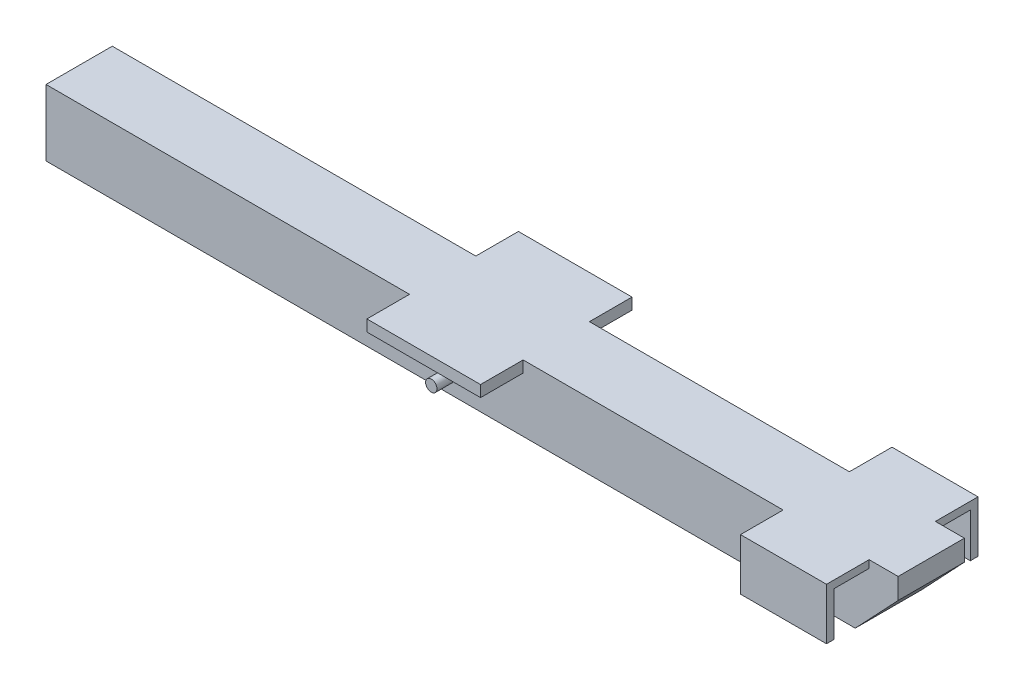
from build123d import *

# Parameters (mm, degrees)
BOSS_EXTRUDE1_DEPTH      = 889
BOSS_EXTRUDE3_DEPTH      = 571.5
BOSS_EXTRUDE3_DEPTH_BACK = 1460.5
SKETCH5_W                = 1153.702812307
SKETCH5_H                = 691.768195519
SKETCH5_W_2              = 1524
SKETCH5_H_2              = 152.4
CUT_EXTRUDE3_REACH       = 11174.441
SKETCH6_W                = 468.477816715
SKETCH6_H                = 590.168195519
BOSS_EXTRUDE4_DEPTH      = 469.9
BOSS_EXTRUDE4_DEPTH_BACK = 1358.9
SKETCH7_R                = 76.2
SKETCH8_W                = 736.6
SKETCH8_H                = 736.6
CUT_EXTRUDE4_DEPTH       = 10551.414


with BuildPart() as part:
    # Sketch1 → Boss-Extrude1 (new body)
    with BuildSketch(Plane.XY):
        Polygon((0, 0), (10854.702616032, 0), (11430, 609.6), (11430, 889), (0, 889), align=None)
    extrude(amount=BOSS_EXTRUDE1_DEPTH)

    # Sketch5 → Boss-Extrude3 (add, two sides: drawn at the far end of the back side and taken through both)
    with BuildSketch(Plane.XY.offset(889).offset(-BOSS_EXTRUDE3_DEPTH_BACK)):
        with Locations((10463.984643528, 543.11590224)):
            Rectangle(SKETCH5_W, SKETCH5_H)
        with Locations((5637.984643529, 812.8)):
            Rectangle(SKETCH5_W_2, SKETCH5_H_2)
    extrude(amount=BOSS_EXTRUDE3_DEPTH + BOSS_EXTRUDE3_DEPTH_BACK)

    # Sketch6 → Cut-Extrude3 (cut, up to next)
    with BuildSketch(Plane(origin=(11040.836049682, 0, 0), x_dir=(0, 0, -1), z_dir=(1, 0, 0)), mode=Mode.PRIVATE) as cut_extrude3_sk1:
        with Locations((-1123.238908357, 492.315902241)):
            Rectangle(SKETCH6_W, SKETCH6_H)
    cut_extrude3_tool1 = extrude(cut_extrude3_sk1.sketch, amount=-CUT_EXTRUDE3_REACH, mode=Mode.PRIVATE) & part.part
    # Sketch6 → Cut-Extrude3 (cut, up to next)
    with BuildSketch(Plane(origin=(11040.836049682, 0, 0), x_dir=(0, 0, -1), z_dir=(1, 0, 0)), mode=Mode.PRIVATE) as cut_extrude3_sk2:
        with Locations((234.238908358, 492.315902241)):
            Rectangle(SKETCH6_W, SKETCH6_H)
    cut_extrude3_tool2 = extrude(cut_extrude3_sk2.sketch, amount=-CUT_EXTRUDE3_REACH, mode=Mode.PRIVATE) & part.part
    add(cut_extrude3_tool1.solids().sort_by_distance((11040.83605, 492.315902, 1123.238908))[0], mode=Mode.SUBTRACT)
    add(cut_extrude3_tool2.solids().sort_by_distance((11040.83605, 492.315902, -234.238908))[0], mode=Mode.SUBTRACT)

    # Sketch7 → Boss-Extrude4 (add, two sides: drawn at the far end of the back side and taken through both)
    with BuildSketch(Plane.XY.offset(889).offset(-BOSS_EXTRUDE4_DEPTH_BACK)):
        with Locations((5637.984643529, 444.5)):
            Circle(SKETCH7_R)
    extrude(amount=BOSS_EXTRUDE4_DEPTH + BOSS_EXTRUDE4_DEPTH_BACK)

    # Sketch8 → Cut-Extrude4 (cut)
    with BuildSketch(Plane.ZY):
        with Locations((444.5, 444.5)):
            Rectangle(SKETCH8_W, SKETCH8_H)
    extrude(amount=-CUT_EXTRUDE4_DEPTH, mode=Mode.SUBTRACT)


solid = part.part
